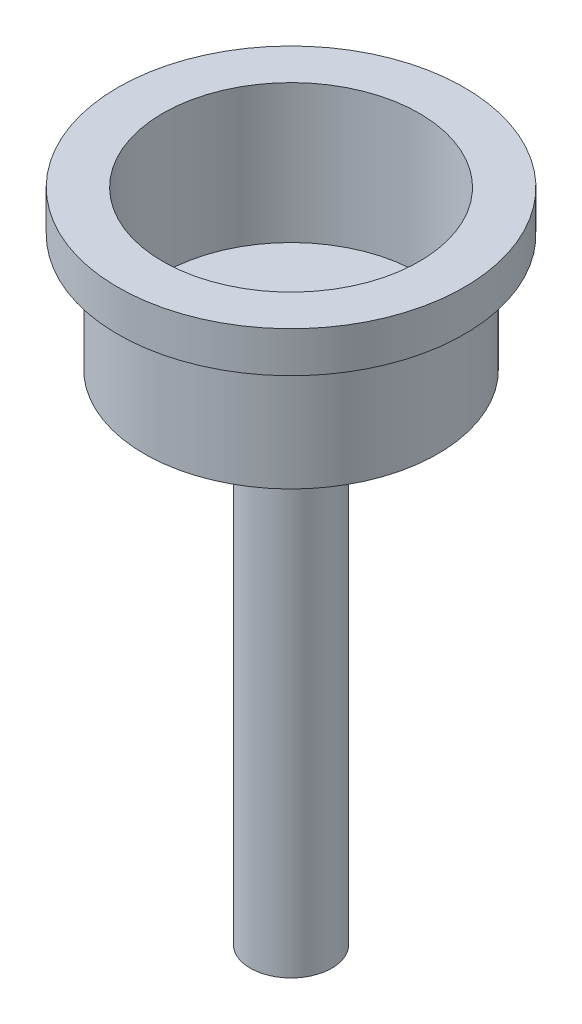
from build123d import *


with BuildPart() as part:
    # 草图1 → 旋转1 (revolve)
    with BuildSketch(Plane.XY, mode=Mode.PRIVATE) as revolve_1_sk:
        Polygon((0.26, 0), (0.3, 0), (0.3, 3.67), (1.08, 3.67), (1.08, 4.53), (1.275, 4.53), (1.275, 4.83), (0.945, 4.83), (0.945, 3.81), (0.26, 3.81), align=None)
    revolve(revolve_1_sk.sketch.rotate(Axis((0, 4.83, 0), (0, -1, 0)), 180), axis=Axis((0, 4.83, 0), (0, -1, 0)))


solid = part.part
